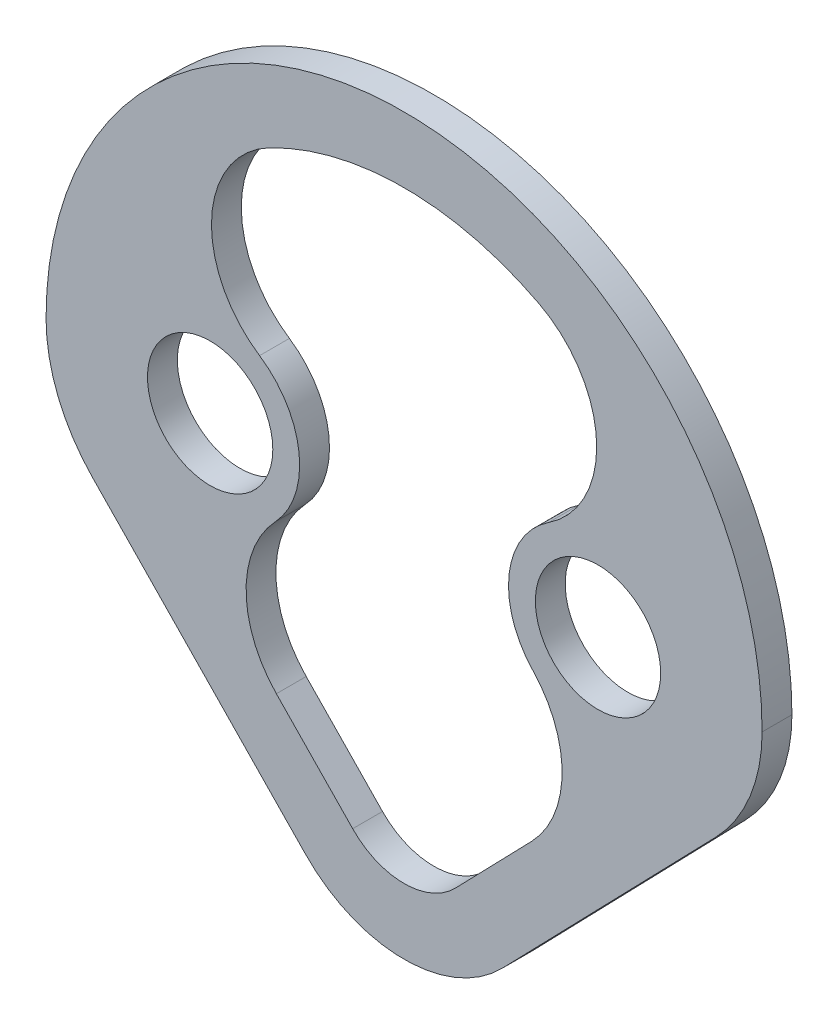
from build123d import *

# Parameters (mm, degrees)
SKETCH2_R           = 10.5
BOSS_EXTRUDE1_DEPTH = 5


with BuildPart() as part:
    # Sketch2 → Boss-Extrude1 (new body)
    with BuildSketch(Plane.XY):
        with BuildLine():
            ThreePointArc((60, 40), (0, 100), (-60, 40))
            ThreePointArc((-60, 40), (-57.988295689, 29.675428199), (-52.2475067, 20.861400806))
            Line((-52.2475067, 20.861400806), (-16.516096513, -16.006828417))
            ThreePointArc((-16.516096513, -16.006828417), (0, -23), (16.516096513, -16.006828417))
            Line((16.516096513, -16.006828417), (52.2475067, 20.861400806))
            ThreePointArc((52.2475067, 20.861400806), (57.988295689, 29.675428199), (60, 40))
        make_face()
        with Locations((32.5, 40)):
            Circle(SKETCH2_R, mode=Mode.SUBTRACT)
        with Locations((-32.5, 40)):
            Circle(SKETCH2_R, mode=Mode.SUBTRACT)
        with BuildLine():
            ThreePointArc((-22.572828784, 83.491003675), (-32.255432897, 68.469423949), (-24.218531469, 52.506689369))
            ThreePointArc((-24.218531469, 52.506689369), (-17.599364702, 41.723678544), (-21.581946383, 29.714276632))
            ThreePointArc((-21.581946383, 29.714276632), (-26.479831206, 17.244012068), (-21.405922791, 4.844325481))
            Line((-21.405922791, 4.844325481), (-8.617093833, -8.351388739))
            ThreePointArc((-8.617093833, -8.351388739), (0, -12), (8.617093833, -8.351388739))
            Line((8.617093833, -8.351388739), (21.405922791, 4.844325481))
            ThreePointArc((21.405922791, 4.844325481), (26.479831206, 17.244012068), (21.581946383, 29.714276632))
            ThreePointArc((21.581946383, 29.714276632), (17.599364702, 41.723678544), (24.218531469, 52.506689369))
            ThreePointArc((24.218531469, 52.506689369), (32.255432897, 68.469423949), (22.572828784, 83.491003675))
            ThreePointArc((22.572828784, 83.491003675), (0, 89), (-22.572828784, 83.491003675))
        make_face(mode=Mode.SUBTRACT)
    extrude(amount=BOSS_EXTRUDE1_DEPTH)


solid = part.part
